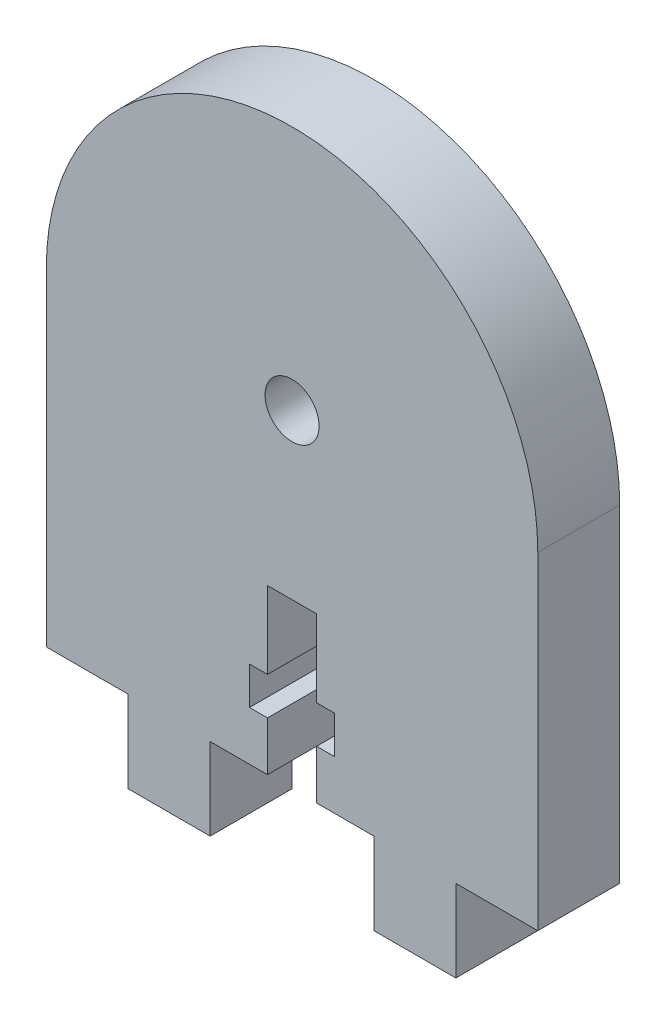
from build123d import *

# Parameters (mm, degrees)
SKETCH1_R           = 1.65
BOSS_EXTRUDE1_DEPTH = 5


with BuildPart() as part:
    # Sketch1 → Boss-Extrude1 (new body)
    with BuildSketch(Plane.XY):
        with BuildLine():
            Line((-10, 0), (-15, 0))
            Line((-15, 0), (-15, 20))
            ThreePointArc((-15, 20), (0, 35), (15, 20))
            Line((15, 20), (15, 0))
            Line((15, 0), (10, 0))
            Line((10, 0), (10, -5))
            Line((10, -5), (5, -5))
            Line((5, -5), (5, 0))
            Line((5, 0), (1.5, 0))
            Line((1.5, 0), (1.5, 3))
            Line((1.5, 3), (2.6, 3))
            Line((2.6, 3), (2.6, 5.3))
            Line((2.6, 5.3), (1.5, 5.3))
            Line((1.5, 5.3), (1.5, 10))
            Line((1.5, 10), (-1.5, 10))
            Line((-1.5, 10), (-1.5, 5.3))
            Line((-1.5, 5.3), (-2.6, 5.3))
            Line((-2.6, 5.3), (-2.6, 3))
            Line((-2.6, 3), (-1.5, 3))
            Line((-1.5, 3), (-1.5, 0))
            Line((-1.5, 0), (-5, 0))
            Line((-5, 0), (-5, -5))
            Line((-5, -5), (-10, -5))
            Line((-10, -5), (-10, 0))
        make_face()
        with Locations((0, 20)):
            Circle(SKETCH1_R, mode=Mode.SUBTRACT)
    extrude(amount=BOSS_EXTRUDE1_DEPTH)


solid = part.part
